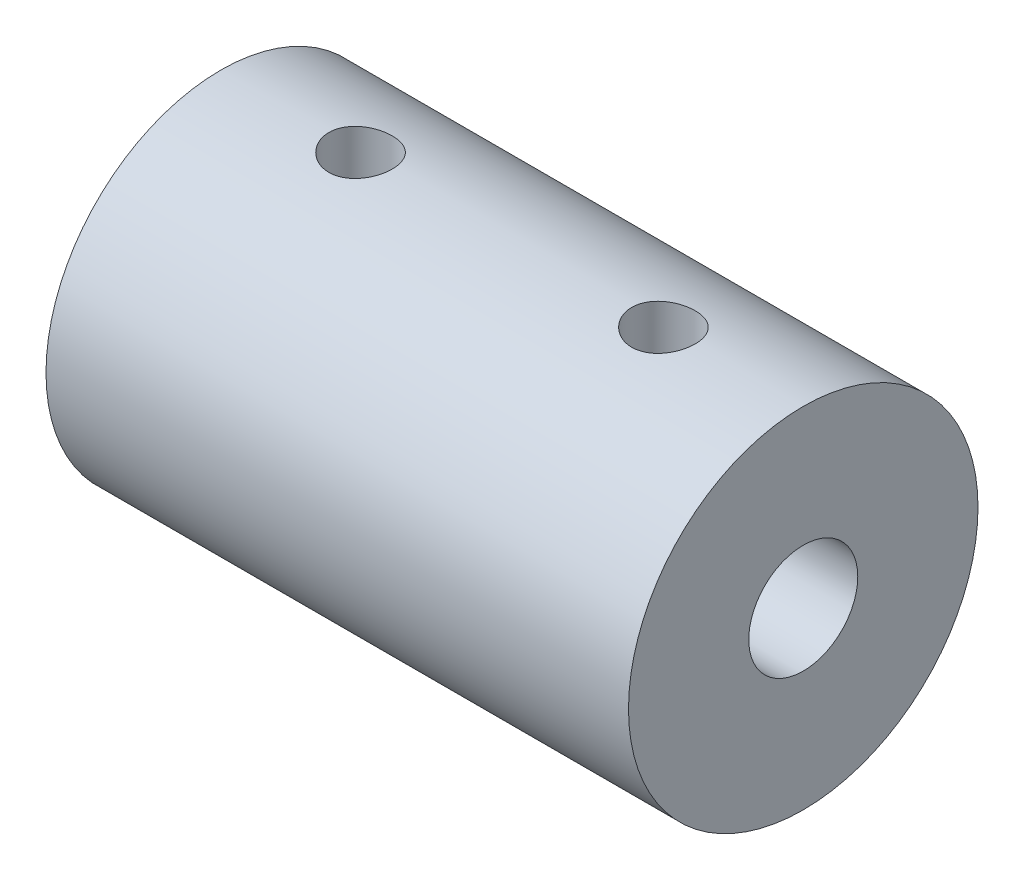
from build123d import *

# Parameters (mm, degrees)
SKETCH1_R                         = 9.525
BOSS_EXTRUDE1_DEPTH               = 15.875
A_DIAMETER_DRIVE_SHAFT_SIDE_D     = 5.9436
A_DIAMETER_DRIVE_SHAFT_SIDE_DEPTH = 12.7
A_DIAMETER_DRIVE_SHAFT_SIDE_TIP   = 1.785637588
A_DIAMETER_MOTOR_SHAFT_SIDE_D     = 5.9436
A_DIAMETER_MOTOR_SHAFT_SIDE_DEPTH = 12.7
A_DIAMETER_MOTOR_SHAFT_SIDE_TIP   = 1.785637588
F_8_32_TAPPED_HOLE1_REACH         = 28.564
F_8_32_TAPPED_HOLE1_BORE_R        = 1.7272


with BuildPart() as part:
    # Sketch1 → Boss-Extrude1 (new, symmetric)
    with BuildSketch(Plane(origin=(0, 0, 0), x_dir=(0, 0, -1), z_dir=(1, 0, 0))):
        Circle(SKETCH1_R)
    extrude(amount=BOSS_EXTRUDE1_DEPTH, both=True)

    # A Diameter Drive Shaft Side
    with Locations(Plane.ZY.offset(15.875)):
        with Locations((0, 0)):
            Hole(A_DIAMETER_DRIVE_SHAFT_SIDE_D / 2, depth=A_DIAMETER_DRIVE_SHAFT_SIDE_DEPTH)
            with Locations((0, 0, -(A_DIAMETER_DRIVE_SHAFT_SIDE_DEPTH + A_DIAMETER_DRIVE_SHAFT_SIDE_TIP / 2))):  # 118° drill point
                Cone(0, A_DIAMETER_DRIVE_SHAFT_SIDE_D / 2, A_DIAMETER_DRIVE_SHAFT_SIDE_TIP, mode=Mode.SUBTRACT)

    # A Diameter Motor Shaft Side
    with Locations(Plane(origin=(15.875, 0, 0), x_dir=(0, 0, -1), z_dir=(1, 0, 0))):
        with Locations((0, 0)):
            Hole(A_DIAMETER_MOTOR_SHAFT_SIDE_D / 2, depth=A_DIAMETER_MOTOR_SHAFT_SIDE_DEPTH)
            with Locations((0, 0, -(A_DIAMETER_MOTOR_SHAFT_SIDE_DEPTH + A_DIAMETER_MOTOR_SHAFT_SIDE_TIP / 2))):  # 118° drill point
                Cone(0, A_DIAMETER_MOTOR_SHAFT_SIDE_D / 2, A_DIAMETER_MOTOR_SHAFT_SIDE_TIP, mode=Mode.SUBTRACT)

    # #8-32 Tapped Hole1 bore → #8-32 Tapped Hole1 (cut, up to next)
    with BuildSketch(Plane(origin=(0, 9.525, 0), x_dir=(1, 0, 0), z_dir=(0, 1, 0)), mode=Mode.PRIVATE) as f_8_32_tapped_hole1_sk1:
        with Locations((-8.255, 0)):
            Circle(F_8_32_TAPPED_HOLE1_BORE_R)
    f_8_32_tapped_hole1_tool1 = extrude(f_8_32_tapped_hole1_sk1.sketch, amount=-F_8_32_TAPPED_HOLE1_REACH, mode=Mode.PRIVATE) & part.part
    # #8-32 Tapped Hole1 bore → #8-32 Tapped Hole1 (cut, up to next)
    with BuildSketch(Plane(origin=(0, 9.525, 0), x_dir=(1, 0, 0), z_dir=(0, 1, 0)), mode=Mode.PRIVATE) as f_8_32_tapped_hole1_sk2:
        with Locations((8.255, 0)):
            Circle(F_8_32_TAPPED_HOLE1_BORE_R)
    f_8_32_tapped_hole1_tool2 = extrude(f_8_32_tapped_hole1_sk2.sketch, amount=-F_8_32_TAPPED_HOLE1_REACH, mode=Mode.PRIVATE) & part.part
    add(f_8_32_tapped_hole1_tool1.solids().sort_by_distance((-8.255, 9.525, 0))[0], mode=Mode.SUBTRACT)
    add(f_8_32_tapped_hole1_tool2.solids().sort_by_distance((8.255, 9.525, 0))[0], mode=Mode.SUBTRACT)


solid = part.part
